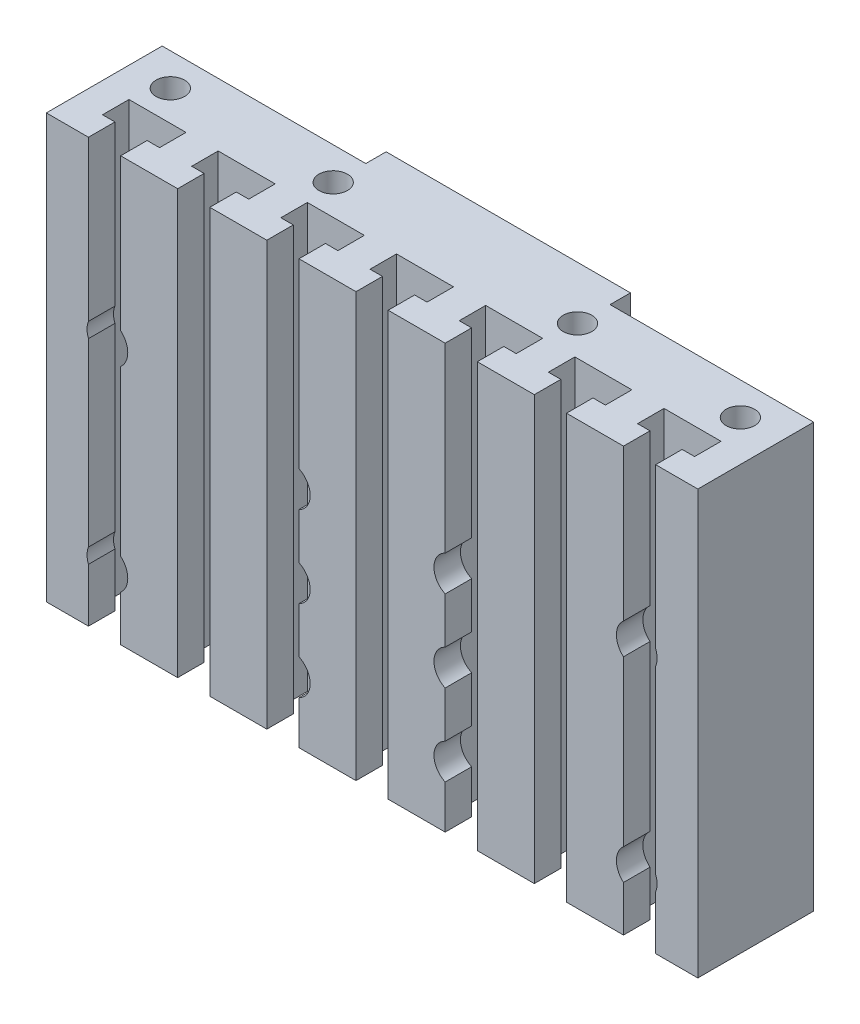
from build123d import *

# Parameters (mm, degrees)
SKETCH1_W           = 160
SKETCH1_H           = 104
SKETCH1_R           = 2.5
BOSS_EXTRUDE1_DEPTH = 28.45
CUT_EXTRUDE1_DEPTH  = 135.258714801
SKETCH5_W           = 60
SKETCH5_H           = 104
BOSS_EXTRUDE2_DEPTH = 5
SKETCH3_R           = 4.8
CUT_EXTRUDE2_DEPTH  = 7
CUT_EXTRUDE3_START  = 6.5
SKETCH4_R           = 4.8
CUT_EXTRUDE3_DEPTH  = 13.35
SKETCH6_R           = 2.5
CUT_EXTRUDE4_DEPTH  = 100.566071028
SKETCH7_R           = 3.5
CUT_EXTRUDE5_DEPTH  = 12
CUT_EXTRUDE6_START  = -12
SKETCH8_R           = 3.5
CUT_EXTRUDE6_DEPTH  = 12
SKETCH9_R           = 5
CUT_EXTRUDE7_DEPTH  = 26


with BuildPart() as part:
    # Sketch1 → Boss-Extrude1 (new body)
    with BuildSketch(Plane.XY):
        Rectangle(SKETCH1_W, SKETCH1_H)
        with Locations((20, -37)):
            Circle(SKETCH1_R, mode=Mode.SUBTRACT)
        with Locations(Location((-20, -37, 0), (0, 0, 180))):
            Circle(SKETCH1_R, mode=Mode.SUBTRACT)
        with Locations((20, -17)):
            Circle(SKETCH1_R, mode=Mode.SUBTRACT)
        with Locations((20, 3)):
            Circle(SKETCH1_R, mode=Mode.SUBTRACT)
        with Locations(Location((-20, 3, 0), (0, 0, 180))):
            Circle(SKETCH1_R, mode=Mode.SUBTRACT)
        with Locations(Location((-20, -17, 0), (0, 0, 180))):
            Circle(SKETCH1_R, mode=Mode.SUBTRACT)
    extrude(amount=BOSS_EXTRUDE1_DEPTH)

    # Sketch2 → Cut-Extrude1 (cut, through all)
    with BuildSketch(Plane(origin=(0, 52, 0), x_dir=(1, 0, 0), z_dir=(0, 1, 0))):
        Polygon((-3.95, -28.45), (3.95, -28.45), (3.95, -21.95), (7, -21.95), (7, -15.45), (-7, -15.45), (-7, -21.95), (-3.95, -21.95), align=None)
        Polygon((25.85, -28.45), (25.85, -21.95), (28.9, -21.95), (28.9, -15.45), (14.9, -15.45), (14.9, -21.95), (17.95, -21.95), (17.95, -28.45), align=None)
        Polygon((47.75, -28.45), (47.75, -21.95), (50.8, -21.95), (50.8, -15.45), (36.8, -15.45), (36.8, -21.95), (39.85, -21.95), (39.85, -28.45), align=None)
        Polygon((69.65, -28.45), (69.65, -21.95), (72.7, -21.95), (72.7, -15.45), (58.7, -15.45), (58.7, -21.95), (61.75, -21.95), (61.75, -28.45), align=None)
        Polygon((-28.9, -15.45), (-28.9, -21.95), (-25.85, -21.95), (-25.85, -28.45), (-17.95, -28.45), (-17.95, -21.95), (-14.9, -21.95), (-14.9, -15.45), align=None)
        Polygon((-50.8, -15.45), (-50.8, -21.95), (-47.75, -21.95), (-47.75, -28.45), (-39.85, -28.45), (-39.85, -21.95), (-36.8, -21.95), (-36.8, -15.45), align=None)
        Polygon((-72.7, -15.45), (-72.7, -21.95), (-69.65, -21.95), (-69.65, -28.45), (-61.75, -28.45), (-61.75, -21.95), (-58.7, -21.95), (-58.7, -15.45), align=None)
    extrude(amount=-CUT_EXTRUDE1_DEPTH, mode=Mode.SUBTRACT)

    # Sketch5 → Boss-Extrude2 (add)
    with BuildSketch(Plane(origin=(0, 0, 0), x_dir=(-1, 0, 0), z_dir=(0, 0, -1))):
        Rectangle(SKETCH5_W, SKETCH5_H)
    extrude(amount=BOSS_EXTRUDE2_DEPTH)

    # Sketch3 → Cut-Extrude2 (cut)
    with BuildSketch(Plane.XY.offset(28.45)):
        with Locations((-20, 3)):
            Circle(SKETCH3_R)
        with Locations((20, 3)):
            Circle(SKETCH3_R)
        with Locations((-20, -17)):
            Circle(SKETCH3_R)
        with Locations((20, -17)):
            Circle(SKETCH3_R)
        with Locations((-20, -37)):
            Circle(SKETCH3_R)
        with Locations((20, -37)):
            Circle(SKETCH3_R)
    extrude(amount=-CUT_EXTRUDE2_DEPTH, mode=Mode.SUBTRACT)

    # Sketch4 → Cut-Extrude3 (cut)
    with BuildSketch(Plane.XY.offset(15.45).offset(CUT_EXTRUDE3_START)):
        with Locations((-20, 3)):
            Circle(SKETCH4_R)
        with Locations((20, 3)):
            Circle(SKETCH4_R)
        with Locations((-20, -17)):
            Circle(SKETCH4_R)
        with Locations((20, -17)):
            Circle(SKETCH4_R)
        with Locations((-20, -37)):
            Circle(SKETCH4_R)
        with Locations((20, -37)):
            Circle(SKETCH4_R)
    extrude(amount=-CUT_EXTRUDE3_DEPTH, mode=Mode.SUBTRACT)

    # Sketch6 → Cut-Extrude4 (cut, through all)
    with BuildSketch(Plane.XY):
        with Locations((-20, 3)):
            Circle(SKETCH6_R)
        with Locations((20, 3)):
            Circle(SKETCH6_R)
        with Locations((-20, -17)):
            Circle(SKETCH6_R)
        with Locations((20, -17)):
            Circle(SKETCH6_R)
        with Locations((20, -37)):
            Circle(SKETCH6_R)
        with Locations((-20, -37)):
            Circle(SKETCH6_R)
    extrude(amount=-CUT_EXTRUDE4_DEPTH, mode=Mode.SUBTRACT)

    # Sketch7 → Cut-Extrude5 (cut)
    with BuildSketch(Plane(origin=(0, 52, 0), x_dir=(1, 0, 0), z_dir=(0, 1, 0))):
        with Locations(Location((-70, -8, 0), (0, 0, 180))):
            Circle(SKETCH7_R)
        with Locations(Location((-30, -8, 0), (0, 0, 180))):
            Circle(SKETCH7_R)
        with Locations((70, -8)):
            Circle(SKETCH7_R)
        with Locations((30, -8)):
            Circle(SKETCH7_R)
    extrude(amount=-CUT_EXTRUDE5_DEPTH, mode=Mode.SUBTRACT)

    # Sketch8 → Cut-Extrude6 (cut)
    with BuildSketch(Plane.XZ.offset(52).offset(CUT_EXTRUDE6_START)):
        with Locations((70, 8)):
            Circle(SKETCH8_R)
        with Locations((30, 8)):
            Circle(SKETCH8_R)
        with Locations(Location((-30, 8, 0), (0, 0, 180))):
            Circle(SKETCH8_R)
        with Locations(Location((-70, 8, 0), (0, 0, 180))):
            Circle(SKETCH8_R)
    extrude(amount=CUT_EXTRUDE6_DEPTH, mode=Mode.SUBTRACT)

    # Sketch9 → Cut-Extrude7 (cut)
    with BuildSketch(Plane.XY.offset(28.45)):
        with Locations((-65, 11)):
            Circle(SKETCH9_R)
        with Locations((-65, -37)):
            Circle(SKETCH9_R)
        with Locations((65, -37)):
            Circle(SKETCH9_R)
        with Locations((65, 11)):
            Circle(SKETCH9_R)
    extrude(amount=-CUT_EXTRUDE7_DEPTH, mode=Mode.SUBTRACT)


solid = part.part
